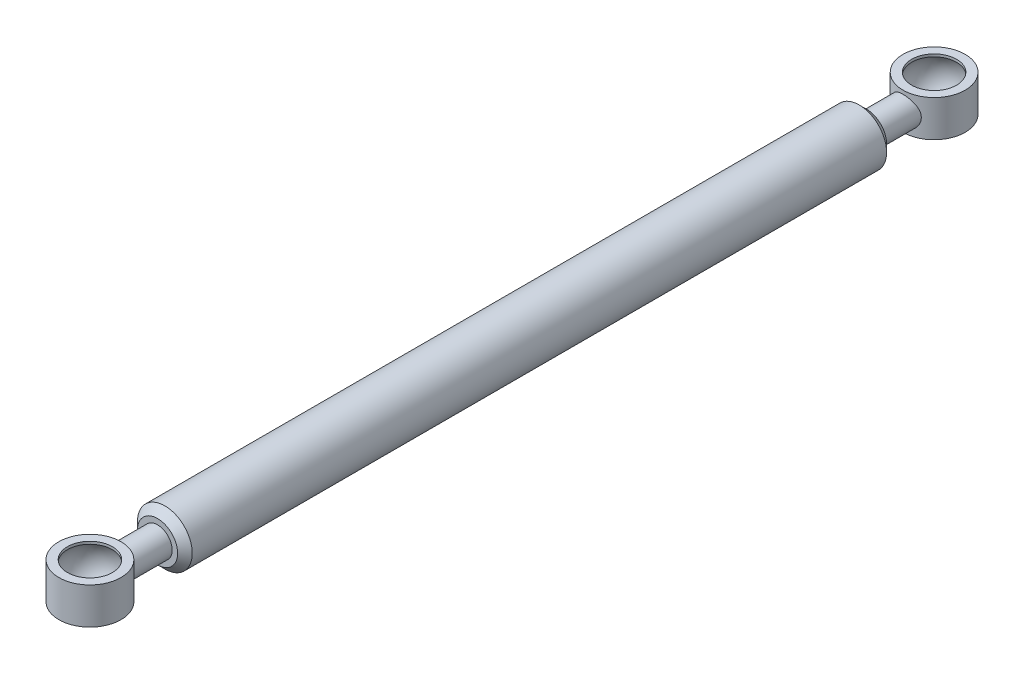
from build123d import *

# Parameters (mm, degrees)
BOSS_EXTRUDE1_START             = -1
SKETCH2_R                       = 4
BOSS_EXTRUDE1_DEPTH             = 11
SKETCH3_R                       = 7.5
BOSS_EXTRUDE2_DEPTH             = 194
CHAMFER1_SIZE                   = 2
CHAMFER2_SIZE                   = 2
BOSS_EXTRUDE3_REACH             = 233.278
BOSS_EXTRUDE3_END_RADIUS        = 8.5
SKETCH5_R                       = 4
BOSS_EXTRUDE3_DIRECTION_2_DEPTH = 10


with BuildPart() as part:
    # Sketch1 → Revolve2 (revolve)
    with BuildSketch(Plane.XY):
        with BuildLine():
            Line((6.148407421, 4.295007123), (6.148407421, 5))
            Line((6.148407421, 5), (8.5, 5))
            Line((8.5, 5), (8.5, -5))
            Line((8.5, -5), (6.148407421, -5))
            Line((6.148407421, -5), (6.148407421, -4.295007123))
            ThreePointArc((6.148407421, -4.295007123), (7.5, 0), (6.148407421, 4.295007123))
        make_face()
    revolve(axis=Axis((0, -1000, 0), (0, 1, 0)))

    # Sketch2 → Boss-Extrude1 (add)
    with BuildSketch(Plane.XY.offset(8.5).offset(BOSS_EXTRUDE1_START)):
        Circle(SKETCH2_R)
    extrude(amount=BOSS_EXTRUDE1_DEPTH)

    # Sketch3 → Boss-Extrude2 (add)
    with BuildSketch(Plane.XY.offset(18.5)):
        with Locations(Location((0, 0, 0), (0, 0, 180))):
            Circle(SKETCH3_R)
    extrude(amount=BOSS_EXTRUDE2_DEPTH)

    # Chamfer1
    chamfer1_edges = [part.edges().sort_by_distance(p)[0] for p in [
        (7.5, 0, 18.5),
    ]]
    chamfer(chamfer1_edges, length=CHAMFER1_SIZE)

    # Chamfer2
    chamfer2_edges = [part.edges().sort_by_distance(p)[0] for p in [
        (7.5, 0, 212.5),
    ]]
    chamfer(chamfer2_edges, length=CHAMFER2_SIZE)



with BuildPart() as body_2:
    # Sketch4 → Revolve3 (revolve)
    with BuildSketch(Plane.XY.offset(231)):
        with BuildLine():
            Line((6.148407421, 5), (6.148407421, 4.295007123))
            ThreePointArc((6.148407421, 4.295007123), (7.5, 0), (6.148407421, -4.295007123))
            Line((6.148407421, -4.295007123), (6.148407421, -5))
            Line((6.148407421, -5), (8.5, -5))
            Line((8.5, -5), (8.5, 5))
            Line((8.5, 5), (6.148407421, 5))
        make_face()
    revolve(axis=Axis((0, -1000, 231), (0, 1, 0)))


with BuildPart() as part_1:
    add(part.part)

    add(body_2.part)  # Boss-Extrude3 merges body 2
    # Boss-Extrude3: up to this cylinder (the profile starts outside it)
    boss_extrude3_end = Plane(origin=(0, 0, 231), z_dir=(0, -1, 0)) * Cylinder(BOSS_EXTRUDE3_END_RADIUS, 484.556, mode=Mode.PRIVATE)
    # Sketch5 → Boss-Extrude3 (add, up to the surface)
    with BuildSketch(Plane(origin=(0, 0, 222.5), x_dir=(-1, 0, 0), z_dir=(0, 0, -1)), mode=Mode.PRIVATE) as boss_extrude3_sk1:
        with Locations(Location((0, 0, 0), (0, 0, 180))):
            Circle(SKETCH5_R)
    boss_extrude3_tool1 = extrude(boss_extrude3_sk1.sketch, amount=-BOSS_EXTRUDE3_REACH, mode=Mode.PRIVATE) - boss_extrude3_end
    add(boss_extrude3_tool1.solids().sort_by_distance((0, 0, 222.5))[0])
    add(boss_extrude3_tool1.solids().sort_by_distance((0, 0, 222.5))[1])

    # Sketch5 → Boss-Extrude3 direction 2 (add)
    with BuildSketch(Plane(origin=(0, 0, 222.5), x_dir=(-1, 0, 0), z_dir=(0, 0, -1))):
        with Locations(Location((0, 0, 0), (0, 0, 180))):
            Circle(SKETCH5_R)
    extrude(amount=BOSS_EXTRUDE3_DIRECTION_2_DEPTH)


solid = part_1.part
